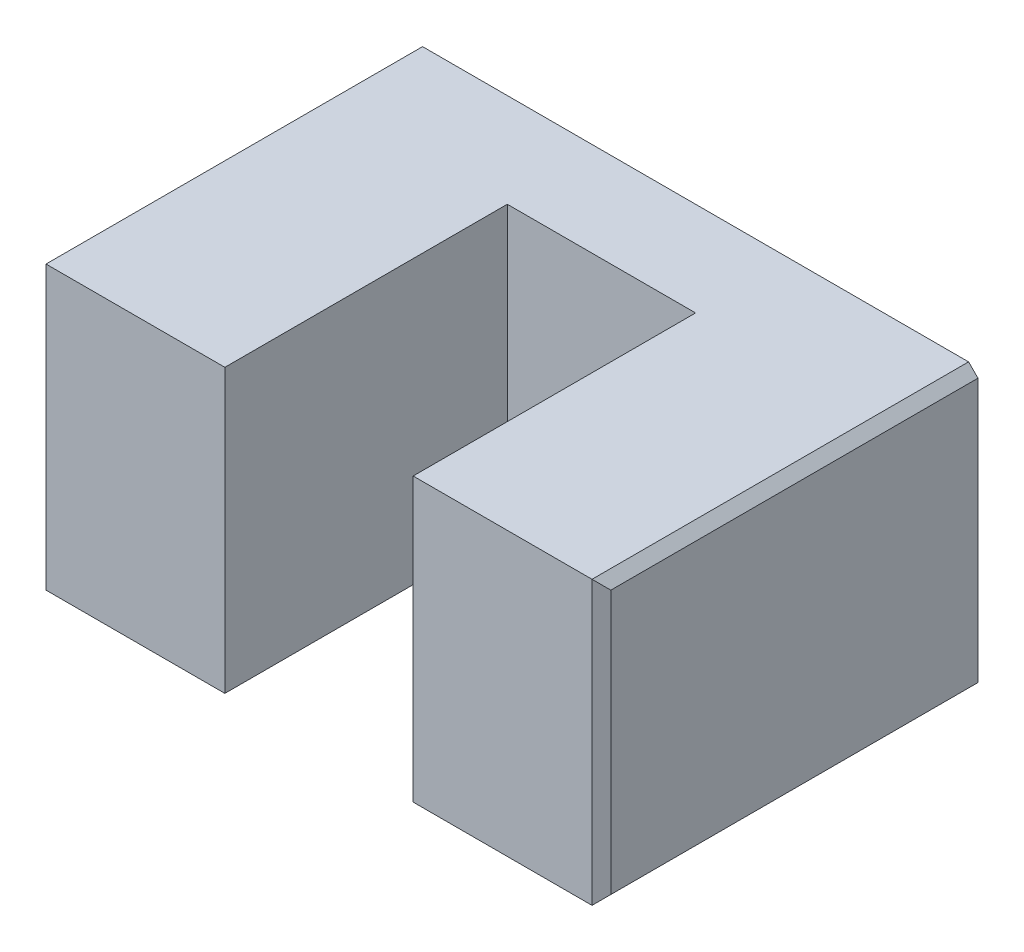
from build123d import *

# Parameters (mm, degrees)
BOSS_EXTRUDE1_DEPTH = 30
SKETCH2_R           = 20
BOSS_EXTRUDE2_DEPTH = 5
SKETCH3_R           = 10
CUT_EXTRUDE1_DEPTH  = 20
CHAMFER1_SIZE       = 1


with BuildPart() as part:
    # Sketch1 → Boss-Extrude1 (new body)
    with BuildSketch(Plane(origin=(0, 0, 0), x_dir=(1, 0, 0), z_dir=(0, 1, 0))):
        Polygon((-30, 0), (-30, -40), (-10, -40), (-10, -10), (10, -10), (10, -40), (30, -40), (30, 0), align=None)
    extrude(amount=BOSS_EXTRUDE1_DEPTH)

    # Sketch2 → Boss-Extrude2 (add)
    with BuildSketch(Plane.XY):
        Circle(SKETCH2_R)
    extrude(amount=BOSS_EXTRUDE2_DEPTH)

    # Sketch3 → Cut-Extrude1 (cut)
    with BuildSketch(Plane.XY):
        Circle(SKETCH3_R)
    extrude(amount=CUT_EXTRUDE1_DEPTH, mode=Mode.SUBTRACT)

    # Chamfer1
    chamfer1_edges = [part.edges().sort_by_distance(p)[0] for p in [
        (30, 30, 20),
        (30, 0, 20),
        (30, 15, 40),
        (-30, 30, 20),
        (-30, 0, 20),
        (-30, 15, 40),
    ]]
    chamfer(chamfer1_edges, length=CHAMFER1_SIZE)


solid = part.part
